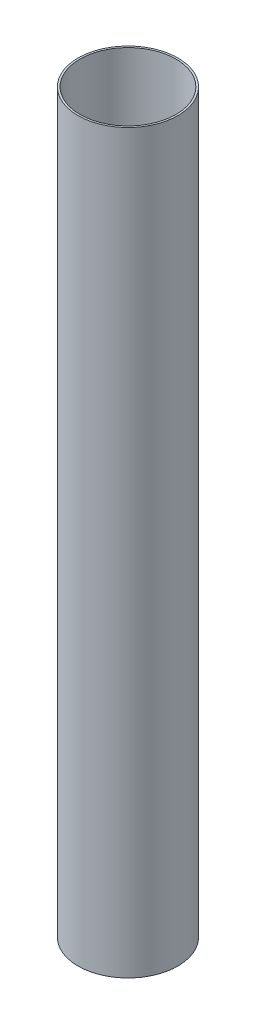
from build123d import *

# Parameters (mm, degrees)
SKETCH4_R           = 39.6
SKETCH4_R_2         = 38.1
BOSS_EXTRUDE2_DEPTH = 584.2


with BuildPart() as part:
    # Sketch4 → Boss-Extrude2 (new body)
    with BuildSketch(Plane(origin=(0, 0, 0), x_dir=(1, 0, 0), z_dir=(0, 1, 0))):
        with Locations(Location((-10.030463542, 2.712784458, 0), (0, 0, 270))):
            Circle(SKETCH4_R)
        with Locations(Location((-10.030463542, 2.712784458, 0), (0, 0, 270))):
            Circle(SKETCH4_R_2, mode=Mode.SUBTRACT)
    extrude(amount=BOSS_EXTRUDE2_DEPTH)


solid = part.part
